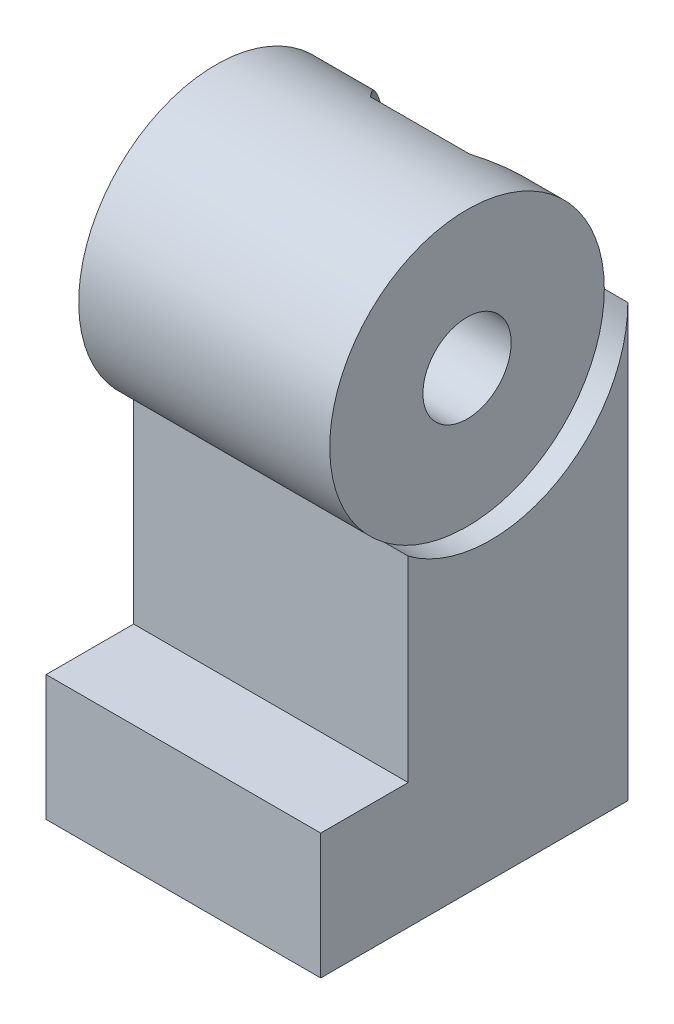
from build123d import *

# Parameters (mm, degrees)
BOSS_EXTRUDE1_DEPTH = 7
CUT_EXTRUDE1_START  = -0.6
SKETCH2_R           = 3.5
CUT_EXTRUDE1_DEPTH  = 0.6
SKETCH3_R           = 1.125
CUT_EXTRUDE2_DEPTH  = 4
SKETCH4_R           = 2.5
CUT_EXTRUDE3_DEPTH  = 1.8
SKETCH5_W           = 5
SKETCH5_H           = 5
CUT_EXTRUDE4_DEPTH  = 2.2
SKETCH7_W           = 5
SKETCH7_H           = 3.3
CUT_EXTRUDE5_DEPTH  = 9
CUT_EXTRUDE6_DEPTH  = 3


with BuildPart() as part:
    # Sketch1 → Boss-Extrude1 (new body)
    with BuildSketch(Plane(origin=(0, 0, 0), x_dir=(0, 0, -1), z_dir=(1, 0, 0))):
        with BuildLine():
            Line((7.83, 0), (7.83, 11))
            ThreePointArc((7.83, 11), (2.764752416, 14.130495168), (2.23, 8.2))
            Line((2.23, 8.2), (2.23, 3.2))
            Line((2.23, 3.2), (0, 3.2))
            Line((0, 3.2), (0, 0))
            Line((0, 0), (7.83, 0))
        make_face()
    extrude(amount=BOSS_EXTRUDE1_DEPTH)

    # Sketch2 → Cut-Extrude1 (cut)
    with BuildSketch(Plane(origin=(7, 0, 0), x_dir=(0, 0, -1), z_dir=(1, 0, 0)).offset(CUT_EXTRUDE1_START)):
        with Locations((4.33, 11)):
            Circle(SKETCH2_R)
    extrude(amount=CUT_EXTRUDE1_DEPTH, mode=Mode.SUBTRACT)

    # Sketch3 → Cut-Extrude2 (cut)
    with BuildSketch(Plane(origin=(6.4, 0, 0), x_dir=(0, 0, -1), z_dir=(1, 0, 0))):
        with Locations((4.33, 11)):
            Circle(SKETCH3_R)
    extrude(amount=-CUT_EXTRUDE2_DEPTH, mode=Mode.SUBTRACT)

    # Sketch4 → Cut-Extrude3 (cut)
    with BuildSketch(Plane(origin=(0, 0, -7.83), x_dir=(-1, 0, 0), z_dir=(0, 0, -1))):
        with Locations((-3.5, 3.9)):
            Circle(SKETCH4_R)
        with Locations((-3.5, 11.9)):
            Circle(SKETCH4_R)
    extrude(amount=-CUT_EXTRUDE3_DEPTH, mode=Mode.SUBTRACT)

    # Sketch5 → Cut-Extrude4 (cut)
    with BuildSketch(Plane.XZ):
        with Locations((3.5, -3.9)):
            Rectangle(SKETCH5_W, SKETCH5_H)
    extrude(amount=-CUT_EXTRUDE4_DEPTH, mode=Mode.SUBTRACT)

    # Sketch7 → Cut-Extrude5 (cut)
    with BuildSketch(Plane.XZ):
        with Locations((3.5, -4.75)):
            Rectangle(SKETCH7_W, SKETCH7_H)
    extrude(amount=-CUT_EXTRUDE5_DEPTH, mode=Mode.SUBTRACT)

    # Sketch8 → Cut-Extrude6 (cut)
    with BuildSketch(Plane(origin=(0, 0, -6.03), x_dir=(-1, 0, 0), z_dir=(0, 0, -1))):
        with BuildLine():
            Line((-4.4, 13.159411708), (-4.4, 9.567619242))
            ThreePointArc((-4.4, 9.567619242), (-2.672675915, 9.540861416), (-1.340397687, 10.640588292))
            Line((-1.340397687, 10.640588292), (-1.340397687, 13.159411708))
            Line((-1.340397687, 13.159411708), (-4.4, 13.159411708))
        make_face()
    extrude(amount=-CUT_EXTRUDE6_DEPTH, mode=Mode.SUBTRACT)


solid = part.part
